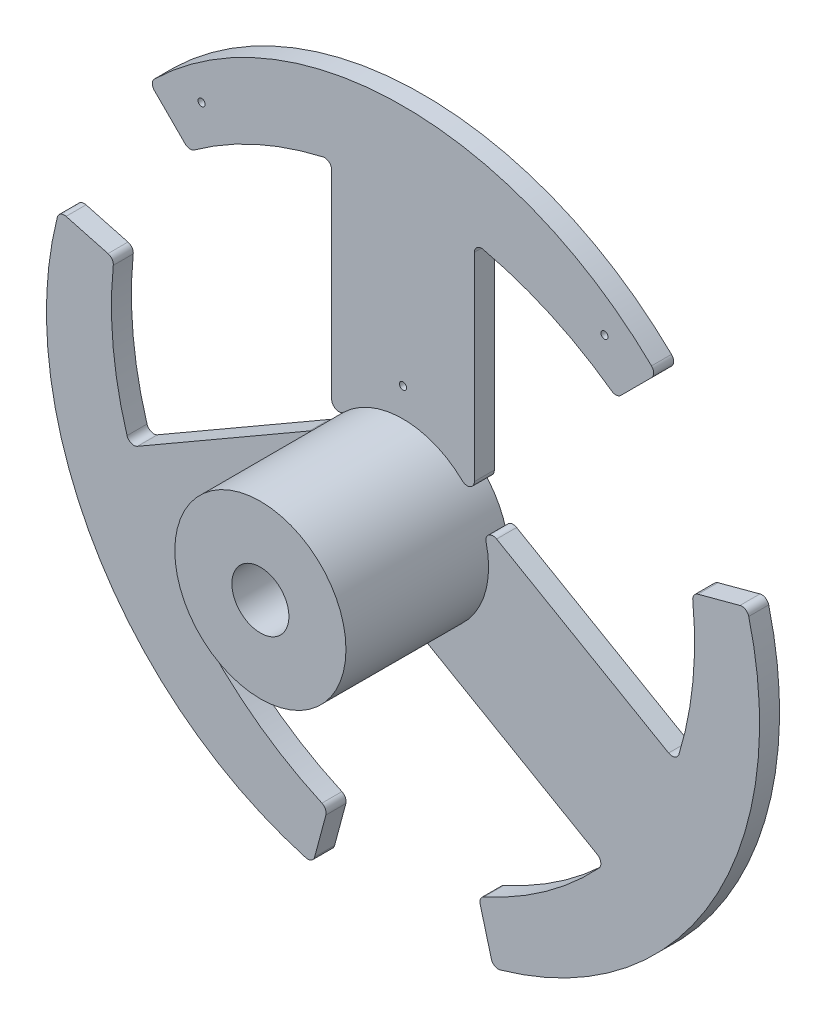
from build123d import *

# Parameters (mm, degrees)
SKETCH1_R             = 1.25
BOSS_EXTRUDE1_DEPTH   = 7
BOSS_EXTRUDE2_DEPTH   = 7
BOSS_EXTRUDE2_2_DEPTH = 7
SKETCH1_7_R           = 10
BOSS_EXTRUDE3_DEPTH   = 57


with BuildPart() as part:
    # Sketch1 → Boss-Extrude1 (new body)
    with BuildSketch(Plane.XY):
        with BuildLine():
            ThreePointArc((-60.491152811, 74.636373352), (-39.71763232, 82.992417004), (-18.944111829, 74.636373352))
            ThreePointArc((-18.944111829, 74.636373352), (-16.23263232, 74.140273701), (-14.712985122, 76.440036381))
            Line((-14.712985122, 76.440036381), (-14.712985122, 146.054710198))
            ThreePointArc((-14.712985122, 146.054710198), (-13.769696668, 148.010892491), (-11.651665791, 148.490879447))
            ThreePointArc((-11.651665791, 148.490879447), (11.907367753, 140.523795103), (33.422869053, 128.050395473))
            ThreePointArc((33.422869053, 128.050395473), (35.085920842, 127.585787298), (36.653446033, 128.309988089))
            Line((36.653446033, 128.309988089), (47.420811552, 139.077353608))
            ThreePointArc((47.420811552, 139.077353608), (48.15298045, 140.863029774), (47.395303312, 142.638032879))
            ThreePointArc((47.395303312, 142.638032879), (-39.71763232, 177.992417004), (-126.830567952, 142.638032879))
            ThreePointArc((-126.830567952, 142.638032879), (-127.588245091, 140.863029774), (-126.856076193, 139.077353608))
            Line((-126.856076193, 139.077353608), (-116.088710674, 128.309988089))
            ThreePointArc((-116.088710674, 128.309988089), (-114.521185483, 127.585787298), (-112.858133693, 128.050395473))
            ThreePointArc((-112.858133693, 128.050395473), (-91.342632394, 140.523795103), (-67.783598849, 148.490879447))
            ThreePointArc((-67.783598849, 148.490879447), (-65.665567973, 148.010892491), (-64.722279519, 146.054710198))
            Line((-64.722279519, 146.054710198), (-64.722279519, 76.440036381))
            ThreePointArc((-64.722279519, 76.440036381), (-63.20263232, 74.140273701), (-60.491152811, 74.636373352))
        make_face()
        with Locations((-39.71763232, 92.992417004)):
            Circle(SKETCH1_R, mode=Mode.SUBTRACT)
        with Locations((-110.327911654, 143.762392505)):
            Circle(SKETCH1_R, mode=Mode.SUBTRACT)
        with Locations((30.892647013, 143.762392505)):
            Circle(SKETCH1_R, mode=Mode.SUBTRACT)
    extrude(amount=BOSS_EXTRUDE1_DEPTH)



with BuildPart() as body_2:
    # Sketch1<5> → Boss-Extrude2 (new body)
    with BuildSketch(Plane.XY):
        with BuildLine():
            Line((-31.91372188, 19.613947629), (28.374354121, -15.19338928))
            ThreePointArc((28.374354121, -15.19338928), (29.596813454, -16.988392191), (28.953478913, -19.062654214))
            ThreePointArc((28.953478913, -19.062654214), (10.274264705, -35.481833579), (-11.285766896, -47.878104465))
            ThreePointArc((-11.285766896, -47.878104465), (-12.519655272, -49.086045475), (-12.676241586, -50.805662507))
            Line((-12.676241586, -50.805662507), (-8.735112274, -65.514157338))
            ThreePointArc((-8.735112274, -65.514157338), (-7.5547558, -67.041072287), (-5.638719451, -67.272406189))
            ThreePointArc((-5.638719451, -67.272406189), (68.535543153, -9.507582996), (81.474216181, 83.611624322))
            ThreePointArc((81.474216181, 83.611624322), (80.31585697, 85.155293524), (78.403331598, 85.414054741))
            Line((78.403331598, 85.414054741), (63.694836768, 81.47292543))
            ThreePointArc((63.694836768, 81.47292543), (62.28389789, 80.477509189), (61.854734477, 78.804960004))
            ThreePointArc((61.854734477, 78.804960004), (61.899264778, 53.935289488), (57.019445442, 29.549025778))
            ThreePointArc((57.019445442, 29.549025778), (55.544749107, 27.954750711), (53.37900132, 28.115930093))
            Line((53.37900132, 28.115930093), (-6.909074682, 62.923267002))
            ThreePointArc((-6.909074682, 62.923267002), (-9.660551185, 62.757095263), (-10.586656039, 60.160835301))
            ThreePointArc((-10.586656039, 60.160835301), (-13.736870207, 37.992417004), (-31.360176529, 24.180042358))
            ThreePointArc((-31.360176529, 24.180042358), (-33.145551185, 22.079882047), (-31.91372188, 19.613947629))
        make_face()
    extrude(amount=BOSS_EXTRUDE2_DEPTH)


with BuildPart() as body_3:
    # Sketch1<5> → Boss-Extrude2 2 (new body)
    with BuildSketch(Plane.XY):
        with BuildLine():
            ThreePointArc((-47.52154276, 19.613947629), (-46.289713456, 22.079882047), (-48.075088111, 24.180042358))
            ThreePointArc((-48.075088111, 24.180042358), (-65.698394434, 37.992417004), (-68.848608602, 60.160835301))
            ThreePointArc((-68.848608602, 60.160835301), (-69.774713456, 62.757095263), (-72.526189959, 62.923267002))
            Line((-72.526189959, 62.923267002), (-132.81426596, 28.115930093))
            ThreePointArc((-132.81426596, 28.115930093), (-134.980013747, 27.954750711), (-136.454710083, 29.549025778))
            ThreePointArc((-136.454710083, 29.549025778), (-141.334529419, 53.935289488), (-141.289999118, 78.804960004))
            ThreePointArc((-141.289999118, 78.804960004), (-141.71916253, 80.477509189), (-143.130101408, 81.47292543))
            Line((-143.130101408, 81.47292543), (-157.838596239, 85.414054741))
            ThreePointArc((-157.838596239, 85.414054741), (-159.751121611, 85.155293524), (-160.909480822, 83.611624322))
            ThreePointArc((-160.909480822, 83.611624322), (-147.970807793, -9.507582996), (-73.79654519, -67.272406189))
            ThreePointArc((-73.79654519, -67.272406189), (-71.88050884, -67.041072287), (-70.700152367, -65.514157338))
            Line((-70.700152367, -65.514157338), (-66.759023055, -50.805662507))
            ThreePointArc((-66.759023055, -50.805662507), (-66.915609368, -49.086045475), (-68.149497745, -47.878104465))
            ThreePointArc((-68.149497745, -47.878104465), (-89.709529345, -35.481833579), (-108.388743554, -19.062654214))
            ThreePointArc((-108.388743554, -19.062654214), (-109.032078095, -16.988392191), (-107.809618762, -15.19338928))
            Line((-107.809618762, -15.19338928), (-47.52154276, 19.613947629))
        make_face()
    extrude(amount=BOSS_EXTRUDE2_2_DEPTH)


with BuildPart() as part_1:
    add(part.part)

    add(body_2.part)  # Boss-Extrude3 merges body 2

    add(body_3.part)  # Boss-Extrude3 merges body 3
    # Sketch1<7> → Boss-Extrude3 (add)
    with BuildSketch(Plane.XY):
        with BuildLine():
            ThreePointArc((-48.075088111, 24.180042358), (-39.71763232, 22.992417004), (-31.360176529, 24.180042358))
            ThreePointArc((-31.360176529, 24.180042358), (-15.73093107, 34.97469897), (-9.71763232, 52.992417004))
            ThreePointArc((-9.71763232, 52.992417004), (-9.935680668, 56.602867914), (-10.586656039, 60.160835301))
            ThreePointArc((-10.586656039, 60.160835301), (-13.736870207, 67.992417004), (-18.944111829, 74.636373352))
            ThreePointArc((-18.944111829, 74.636373352), (-39.71763232, 82.992417004), (-60.491152811, 74.636373352))
            ThreePointArc((-60.491152811, 74.636373352), (-65.698394434, 67.992417004), (-68.848608602, 60.160835301))
            ThreePointArc((-68.848608602, 60.160835301), (-65.698394434, 37.992417004), (-48.075088111, 24.180042358))
        make_face()
        with Locations((-39.71763232, 52.992417004)):
            Circle(SKETCH1_7_R, mode=Mode.SUBTRACT)
    extrude(amount=BOSS_EXTRUDE3_DEPTH)


solid = part_1.part
